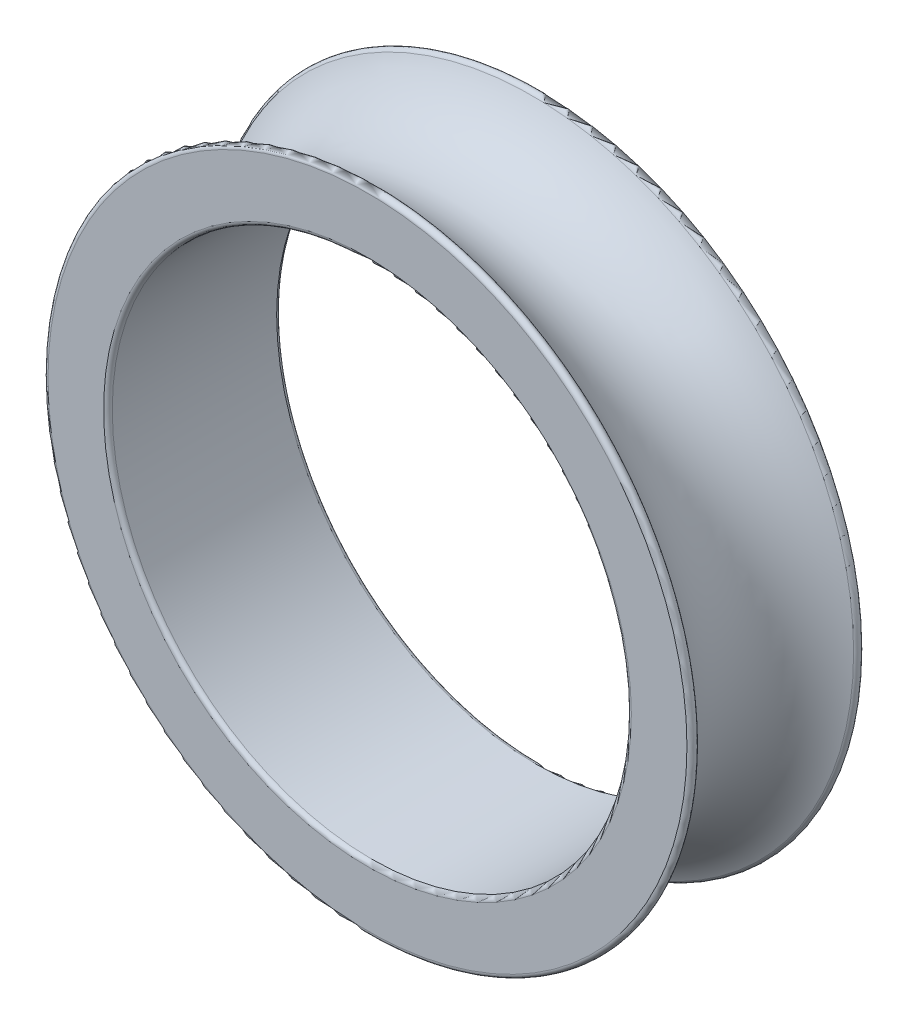
from build123d import *

# Parameters (mm, degrees)
SKETCH1_R               = 21
BOSS_EXTRUDE1_DEPTH     = 10
CUT_EXTRUDE1_DEPTH      = 32.336879232
CUT_EXTRUDE1_DEPTH_BACK = 32.336879232
SKETCH2_R               = 15
FILLET1_R               = 0.25


with BuildPart() as part:
    # Sketch1 → Boss-Extrude1 (new body)
    with BuildSketch(Plane.XY):
        Circle(SKETCH1_R)
    extrude(amount=BOSS_EXTRUDE1_DEPTH)

    # Sketch2 → Cut-Extrude1 (cut, two sides: drawn at the far end of the back side and taken through both)
    with BuildSketch(Plane.XY.offset(10).offset(-CUT_EXTRUDE1_DEPTH_BACK)):
        Circle(SKETCH2_R)
    extrude(amount=CUT_EXTRUDE1_DEPTH + CUT_EXTRUDE1_DEPTH_BACK, mode=Mode.SUBTRACT)

    # Sketch3 → Cut-Revolve1 (revolve, cut)
    with BuildSketch(Plane(origin=(0, 0, 0), x_dir=(1, 0, 0), z_dir=(0, 1, 0))):
        with BuildLine():
            Line((-21, 0), (-21, -10))
            ThreePointArc((-21, -10), (-15.71, -5), (-21, 0))
        make_face()
    revolve(axis=Axis((0, 0, 0), (0, 0, 1)), mode=Mode.SUBTRACT)

    # Fillet1
    fillet1_edges = [part.edges().sort_by_distance(p)[0] for p in [
        (20.435897921, 0, 10),
        (20.435897921, 0, 0),
        (-15, 0, 10),
        (-15, 0, 0),
    ]]
    fillet(fillet1_edges, radius=FILLET1_R)


solid = part.part
